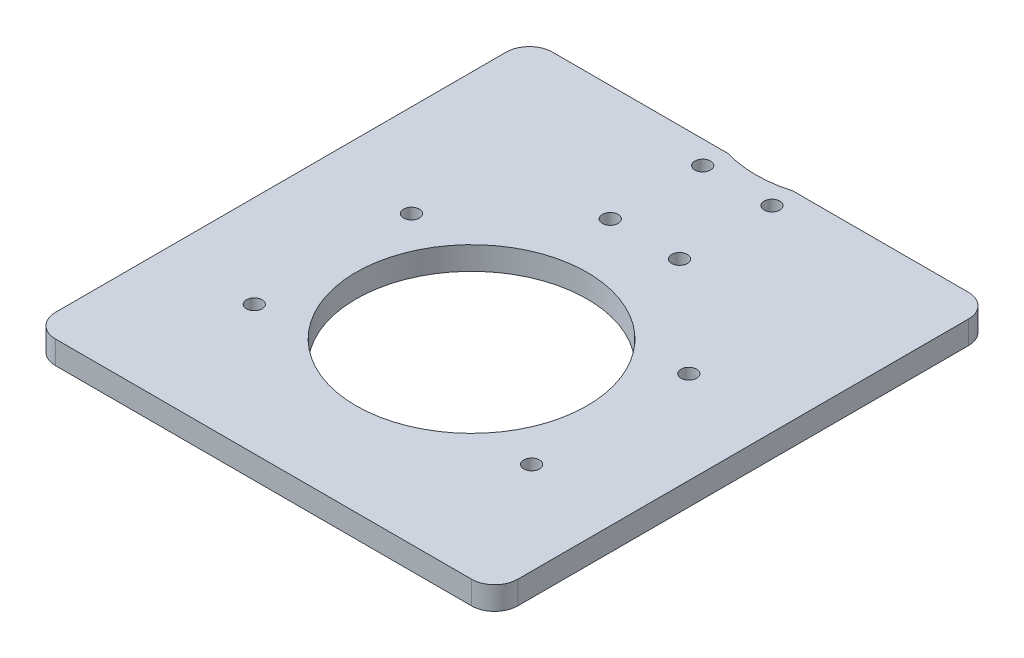
from build123d import *

# Parameters (mm, degrees)
SKETCH1_W             = 200
SKETCH1_H             = 215
EXTRUDE1_DEPTH        = 10
M8_TAPPED_HOLE1_D     = 6.8
M8_TAPPED_HOLE1_DEPTH = 19.75
M8_TAPPED_HOLE1_TIP   = 2.042926105
M8_TAPPED_HOLE2_D     = 6.8
M8_TAPPED_HOLE2_DEPTH = 19.75
M8_TAPPED_HOLE2_TIP   = 2.042926105
SKETCH5_R             = 50
EXTRUDE2_DEPTH        = 10
SKETCH6_R             = 50
EXTRUDE3_DEPTH        = 10
FILLET1_R             = 10
M6_TAPPED_HOLE1_D     = 5
M6_TAPPED_HOLE1_DEPTH = 8
M6_TAPPED_HOLE1_TIP   = 1.502151548


with BuildPart() as part:
    # Sketch1 → Extrude1 (new body)
    with BuildSketch(Plane(origin=(0, 0, 0), x_dir=(1, 0, 0), z_dir=(0, 1, 0))):
        Rectangle(SKETCH1_W, SKETCH1_H)
    extrude(amount=EXTRUDE1_DEPTH)

    # M8 Tapped Hole1
    with Locations(Plane(origin=(-60, 10, -16.5), x_dir=(0, 0, 1), z_dir=(0, 1, 0))):
        with Locations((0, 0), (0, 120), (68, 0), (68, 120)):
            Hole(M8_TAPPED_HOLE1_D / 2, depth=M8_TAPPED_HOLE1_DEPTH)
            with Locations((0, 0, -(M8_TAPPED_HOLE1_DEPTH + M8_TAPPED_HOLE1_TIP / 2))):  # 118° drill point
                Cone(0, M8_TAPPED_HOLE1_D / 2, M8_TAPPED_HOLE1_TIP, mode=Mode.SUBTRACT)

    # M8 Tapped Hole2
    with Locations(Plane(origin=(-15, 10, -97.5), x_dir=(0, 0, 1), z_dir=(0, 1, 0))):
        with Locations((0, 0), (40, 0), (40, 30), (0, 30)):
            Hole(M8_TAPPED_HOLE2_D / 2, depth=M8_TAPPED_HOLE2_DEPTH)
            with Locations((0, 0, -(M8_TAPPED_HOLE2_DEPTH + M8_TAPPED_HOLE2_TIP / 2))):  # 118° drill point
                Cone(0, M8_TAPPED_HOLE2_D / 2, M8_TAPPED_HOLE2_TIP, mode=Mode.SUBTRACT)

    # Sketch5 → Extrude2 (cut)
    with BuildSketch(Plane(origin=(0, 10, 0), x_dir=(1, 0, 0), z_dir=(0, 1, 0))):
        with Locations(Location((0, -17.5, 0), (0, 0, 270))):
            Circle(SKETCH5_R)
    extrude(amount=-EXTRUDE2_DEPTH, mode=Mode.SUBTRACT)

    # Sketch6 → Extrude3 (cut)
    with BuildSketch(Plane(origin=(0, 10, 0), x_dir=(1, 0, 0), z_dir=(0, 1, 0))):
        with Locations((0, 155.5)):
            Circle(SKETCH6_R)
    extrude(amount=-EXTRUDE3_DEPTH, mode=Mode.SUBTRACT)

    # Fillet1
    fillet1_edges = [part.edges().sort_by_distance(p)[0] for p in [
        (-100, 5, -107.5),
        (100, 5, -107.5),
        (100, 5, 107.5),
        (-100, 5, 107.5),
    ]]
    fillet(fillet1_edges, radius=FILLET1_R)

    # M6 Tapped Hole1
    with Locations(Plane(origin=(-56, 0, -38.5), x_dir=(0, 0, -1), z_dir=(0, -1, 0))):
        with Locations((0, 0), (0, 112), (-112, 0), (-112, 112)):
            Hole(M6_TAPPED_HOLE1_D / 2, depth=M6_TAPPED_HOLE1_DEPTH)
            with Locations((0, 0, -(M6_TAPPED_HOLE1_DEPTH + M6_TAPPED_HOLE1_TIP / 2))):  # 118° drill point
                Cone(0, M6_TAPPED_HOLE1_D / 2, M6_TAPPED_HOLE1_TIP, mode=Mode.SUBTRACT)


solid = part.part
